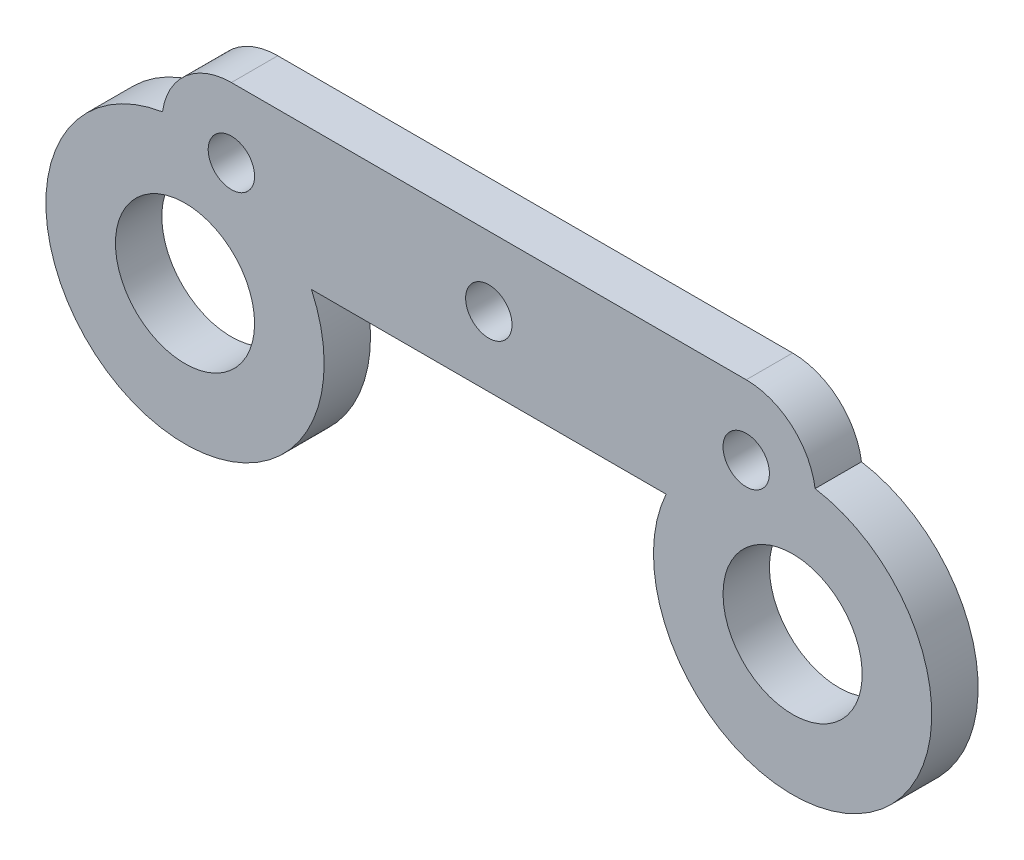
from build123d import *

# Parameters (mm, degrees)
SKETCH1_R           = 1
SKETCH1_R_2         = 3
BOSS_EXTRUDE1_DEPTH = 2
SKETCH2_R           = 0.5
CUT_EXTRUDE1_DEPTH  = 0.5


with BuildPart() as part:
    # Sketch1 → Boss-Extrude1 (new body)
    with BuildSketch(Plane.XY):
        with BuildLine():
            Line((-11.100190374, 3), (11.100190374, 3))
            ThreePointArc((11.100190374, 3), (13.067032348, 2.265288646), (14.070500235, 0.421021768))
            ThreePointArc((14.070500235, 0.421021768), (15.920210774, -10.795987627), (7.645834317, -3))
            Line((7.645834317, -3), (-7.645834317, -3))
            ThreePointArc((-7.645834317, -3), (-15.920210774, -10.795987627), (-14.070500235, 0.421021768))
            ThreePointArc((-14.070500235, 0.421021768), (-13.067032348, 2.265288646), (-11.100190374, 3))
        make_face()
        Circle(SKETCH1_R, mode=Mode.SUBTRACT)
        with Locations((-13.100190374, -5.5)):
            Circle(SKETCH1_R_2, mode=Mode.SUBTRACT)
        with Locations(Location((13.100190374, -5.5, 0), (0, 0, 180))):
            Circle(SKETCH1_R_2, mode=Mode.SUBTRACT)
        with Locations((-11.100190374, 0)):
            Circle(SKETCH1_R, mode=Mode.SUBTRACT)
        with Locations(Location((11.100190374, 0, 0), (0, 0, 180))):
            Circle(SKETCH1_R, mode=Mode.SUBTRACT)
    extrude(amount=BOSS_EXTRUDE1_DEPTH)

    # Sketch2 → Cut-Extrude1 (cut)
    with BuildSketch(Plane.XZ.offset(3)):
        with Locations(Location((0, 1, 0), (0, 0, 270))):
            Circle(SKETCH2_R)
    extrude(amount=-CUT_EXTRUDE1_DEPTH, mode=Mode.SUBTRACT)


solid = part.part
